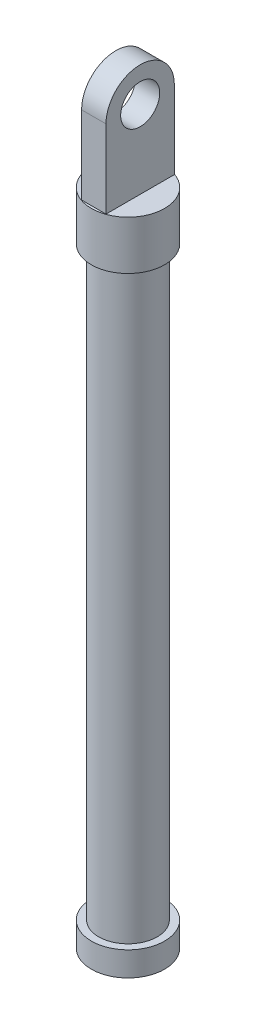
from build123d import *

# Parameters (mm, degrees)
SKETCH_1_R      = 7.5
EXTRUDE_1_DEPTH = 5
SKETCH_2_R      = 6
EXTRUDE_2_DEPTH = 130
SKETCH_3_R      = 4
EXTRUDE_3_DEPTH = 2.5
EXTRUDE_START   = -10
SKETCH_4_R      = 7.5
EXTRUDE_4_DEPTH = 10


with BuildPart() as part:
    # 草圖1 → 填料-伸長1 (new body)
    with BuildSketch(Plane(origin=(0, 0, 0), x_dir=(1, 0, 0), z_dir=(0, 1, 0))):
        with Locations(Location((0, 0, 0), (0, 0, 270))):
            Circle(SKETCH_1_R)
    extrude(amount=EXTRUDE_1_DEPTH)

    # 草圖2 → 填料-伸長2 (add)
    with BuildSketch(Plane(origin=(0, 5, 0), x_dir=(1, 0, 0), z_dir=(0, 1, 0))):
        with Locations(Location((0, 0, 0), (0, 0, 270))):
            Circle(SKETCH_2_R)
    extrude(amount=EXTRUDE_2_DEPTH)

    # 草圖3 → 填料-伸長3 (add, symmetric)
    with BuildSketch(Plane(origin=(0, 0, 0), x_dir=(0, 0, -1), z_dir=(1, 0, 0))):
        with BuildLine():
            Line((-7, 151), (-7, 135))
            Line((-7, 135), (7, 135))
            Line((7, 135), (7, 151))
            ThreePointArc((7, 151), (0, 158), (-7, 151))
        make_face()
        with Locations((0, 151)):
            Circle(SKETCH_3_R, mode=Mode.SUBTRACT)
    extrude(amount=EXTRUDE_3_DEPTH, both=True)

    # 草圖4 → 填料-伸長4 (add)
    with BuildSketch(Plane(origin=(0, 135, 0), x_dir=(1, 0, 0), z_dir=(0, 1, 0)).offset(EXTRUDE_START)):
        with Locations(Location((0, 0, 0), (0, 0, 270))):
            Circle(SKETCH_4_R)
    extrude(amount=EXTRUDE_4_DEPTH)


solid = part.part
